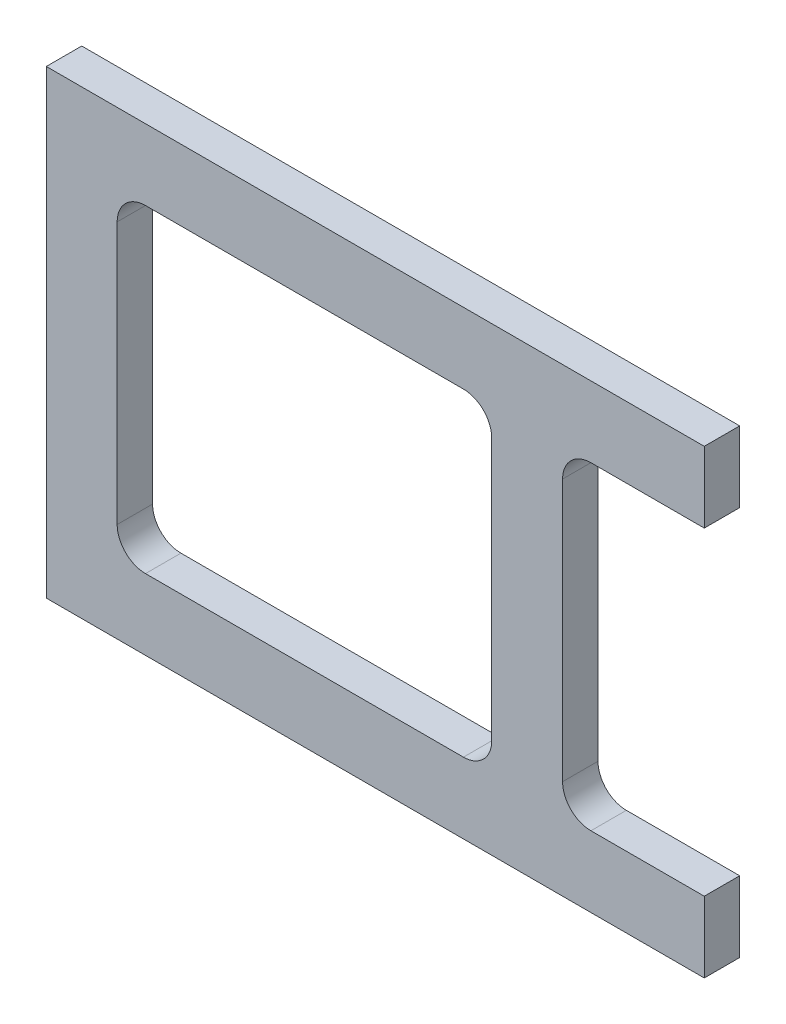
from build123d import *

# Parameters (mm, degrees)
SKETCH1_W           = 58.9788
SKETCH1_H           = 41.275
BOSS_EXTRUDE1_DEPTH = 3.175
SKETCH2_W           = 12.7
SKETCH2_H           = 28.575
SKETCH2_W_2         = 33.5788
CUT_EXTRUDE1_DEPTH  = 37.133249835
FILLET1_R           = 2.54


with BuildPart() as part:
    # Sketch1 → Boss-Extrude1 (new body)
    with BuildSketch(Plane.XY):
        Rectangle(SKETCH1_W, SKETCH1_H)
    extrude(amount=BOSS_EXTRUDE1_DEPTH)

    # Sketch2 → Cut-Extrude1 (cut, through all)
    with BuildSketch(Plane.XY.offset(3.175)):
        with Locations((23.1394, 0)):
            Rectangle(SKETCH2_W, SKETCH2_H)
        with Locations((-6.35, 0)):
            Rectangle(SKETCH2_W_2, SKETCH2_H)
    extrude(amount=-CUT_EXTRUDE1_DEPTH, mode=Mode.SUBTRACT)

    # Fillet1
    fillet1_edges = [part.edges().sort_by_distance(p)[0] for p in [
        (16.7894, -14.2875, 1.5875),
        (16.7894, 14.2875, 1.5875),
        (10.4394, 14.2875, 1.5875),
        (10.4394, -14.2875, 1.5875),
        (-23.1394, -14.2875, 1.5875),
        (-23.1394, 14.2875, 1.5875),
    ]]
    fillet(fillet1_edges, radius=FILLET1_R)


solid = part.part
